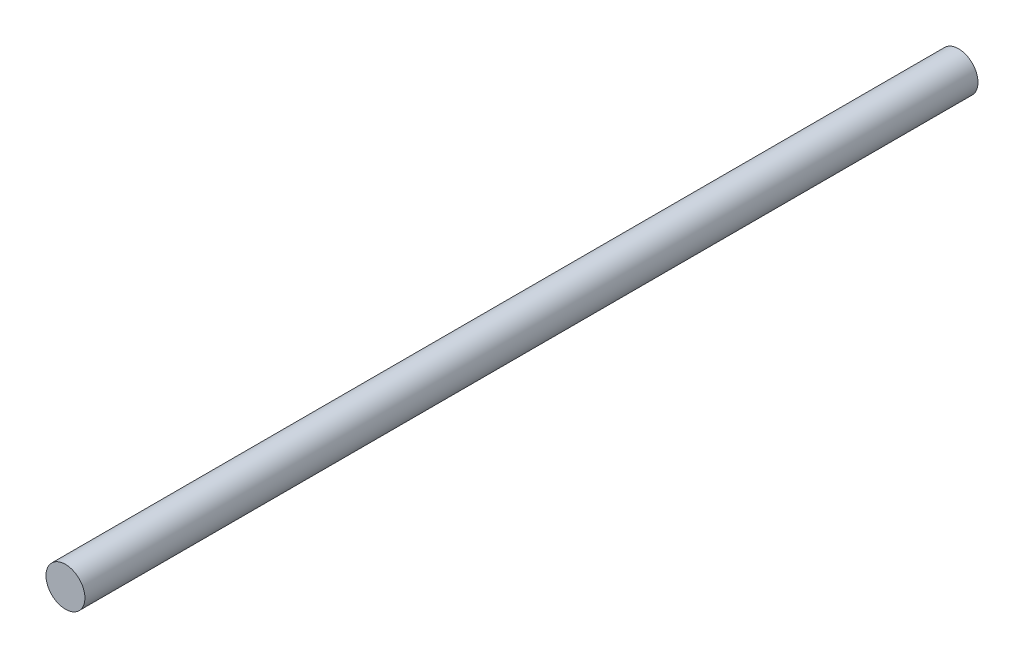
from build123d import *

# Parameters (mm, degrees)
SKETCH2_R           = 10.9
BOSS_EXTRUDE1_DEPTH = 500


with BuildPart() as part:
    # Sketch2 → Boss-Extrude1 (new body)
    with BuildSketch(Plane.XY):
        Circle(SKETCH2_R)
    extrude(amount=-BOSS_EXTRUDE1_DEPTH)


solid = part.part
